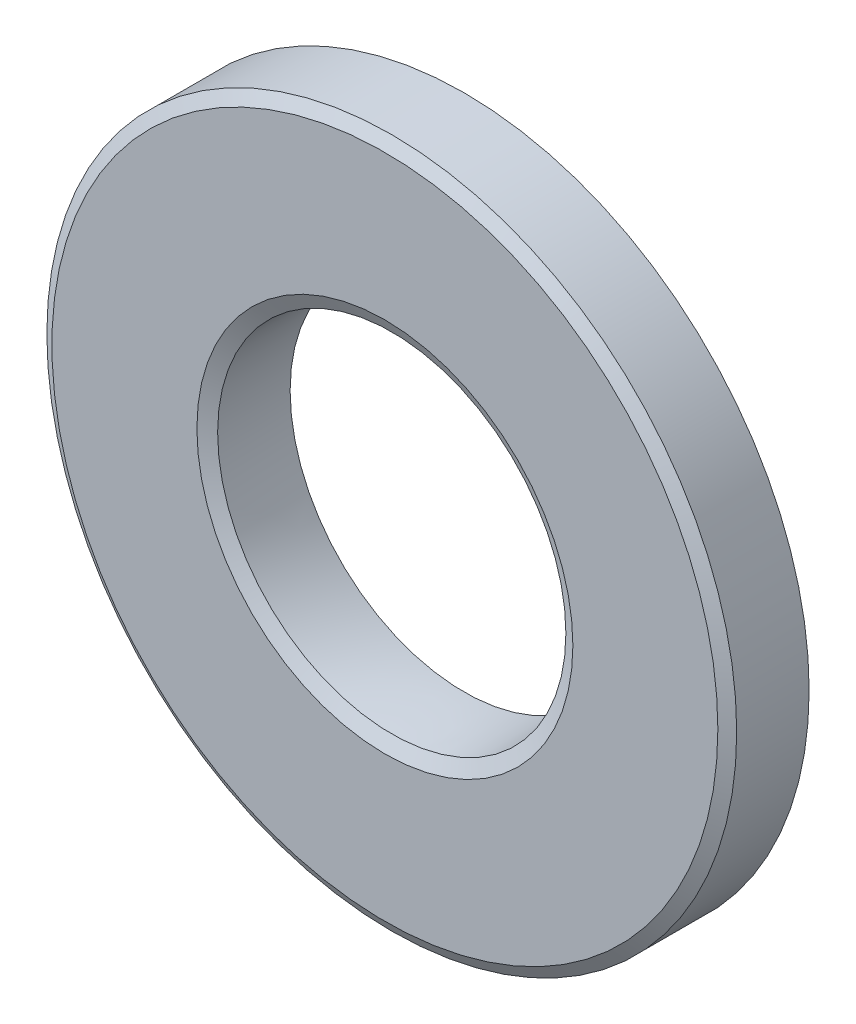
from build123d import *
from OCP.BRepFilletAPI import BRepFilletAPI_MakeChamfer

# Parameters (mm, degrees)
BOSS_EXTRUDE1_DEPTH      = 1.5875
BOSS_EXTRUDE1_DEPTH_BACK = 1.5875
SKETCH3_R                = 12.7
SKETCH3_R_2              = 6.3754
CHAMFER1_SIZE            = 0.254
CHAMFER1_SIZE2           = 0.439940905
CHAMFER2_SIZE            = 0.254
CHAMFER2_SIZE2           = 0.495866606


with BuildPart() as part:
    # Sketch3 → Boss-Extrude1 (new, two sides: drawn at the far end of the back side and taken through both)
    with BuildSketch(Plane.XY.offset(-BOSS_EXTRUDE1_DEPTH_BACK)):
        Circle(SKETCH3_R)
        Circle(SKETCH3_R_2, mode=Mode.SUBTRACT)
    extrude(amount=BOSS_EXTRUDE1_DEPTH + BOSS_EXTRUDE1_DEPTH_BACK)

    # Chamfer1: one chamfer whose edges measure the first distance from different faces: ONE call of the kernel's chamfer builder (chamfer() names one face for all edges)
    chamfer1_edges_1 = [part.edges().sort_by_distance(p)[0] for p in [
        (-12.7, 0, 1.5875),
    ]]
    chamfer1_side_1 = [part.faces().sort_by_distance(p)[0] for p in [
        (-12.7, 0, 0.79375),
    ]]
    chamfer1_edges_2 = [part.edges().sort_by_distance(p)[0] for p in [
        (-12.7, 0, -1.5875),
    ]]
    chamfer1_side_2 = [part.faces().sort_by_distance(p)[0] for p in [
        (-12.7, 0, -0.79375),
    ]]
    chamfer1 = BRepFilletAPI_MakeChamfer(part.part.solid().wrapped)
    for e in chamfer1_edges_1:
        chamfer1.Add(CHAMFER1_SIZE, CHAMFER1_SIZE2, e.wrapped, chamfer1_side_1[0].wrapped)  # the first distance lies on this face
    for e in chamfer1_edges_2:
        chamfer1.Add(CHAMFER1_SIZE, CHAMFER1_SIZE2, e.wrapped, chamfer1_side_2[0].wrapped)  # the first distance lies on this face
    add(Compound.cast(chamfer1.Shape()), mode=Mode.REPLACE)

    # Sketch4 → Cut-Revolve1 (revolve, cut)
    with BuildSketch(Plane(origin=(0, 0, 0), x_dir=(0, 0, -1), z_dir=(1, 0, 0)), mode=Mode.PRIVATE) as cut_revolve1_sk:
        with BuildLine():
            Line((-1.5875, 6.3246), (-1.5875, 6.4262))
            ThreePointArc((-1.5875, 6.4262), (0, 6.3754), (1.5875, 6.4262))
            Line((1.5875, 6.4262), (1.5875, 6.3246))
            Line((1.5875, 6.3246), (-1.5875, 6.3246))
        make_face()
    revolve(cut_revolve1_sk.sketch.rotate(Axis((0, 0, 1.5875), (0, 0, -1)), 90), axis=Axis((0, 0, 1.5875), (0, 0, -1)), mode=Mode.SUBTRACT)

    # Chamfer2: one chamfer whose edges measure the first distance from different faces: ONE call of the kernel's chamfer builder (chamfer() names one face for all edges)
    chamfer2_edges_1 = [part.edges().sort_by_distance(p)[0] for p in [
        (-6.4262, 0, -1.5875),
    ]]
    chamfer2_side_1 = [part.faces().sort_by_distance(p)[0] for p in [
        (-6.38810325, 0, -0.794156296),
    ]]
    chamfer2_edges_2 = [part.edges().sort_by_distance(p)[0] for p in [
        (-6.4262, 0, 1.5875),
    ]]
    chamfer2_side_2 = [part.faces().sort_by_distance(p)[0] for p in [
        (-6.38810325, 0, 0.794156296),
    ]]
    chamfer2 = BRepFilletAPI_MakeChamfer(part.part.solid().wrapped)
    for e in chamfer2_edges_1:
        chamfer2.Add(CHAMFER2_SIZE, CHAMFER2_SIZE2, e.wrapped, chamfer2_side_1[0].wrapped)  # the first distance lies on this face
    for e in chamfer2_edges_2:
        chamfer2.Add(CHAMFER2_SIZE, CHAMFER2_SIZE2, e.wrapped, chamfer2_side_2[0].wrapped)  # the first distance lies on this face
    add(Compound.cast(chamfer2.Shape()), mode=Mode.REPLACE)


solid = part.part
